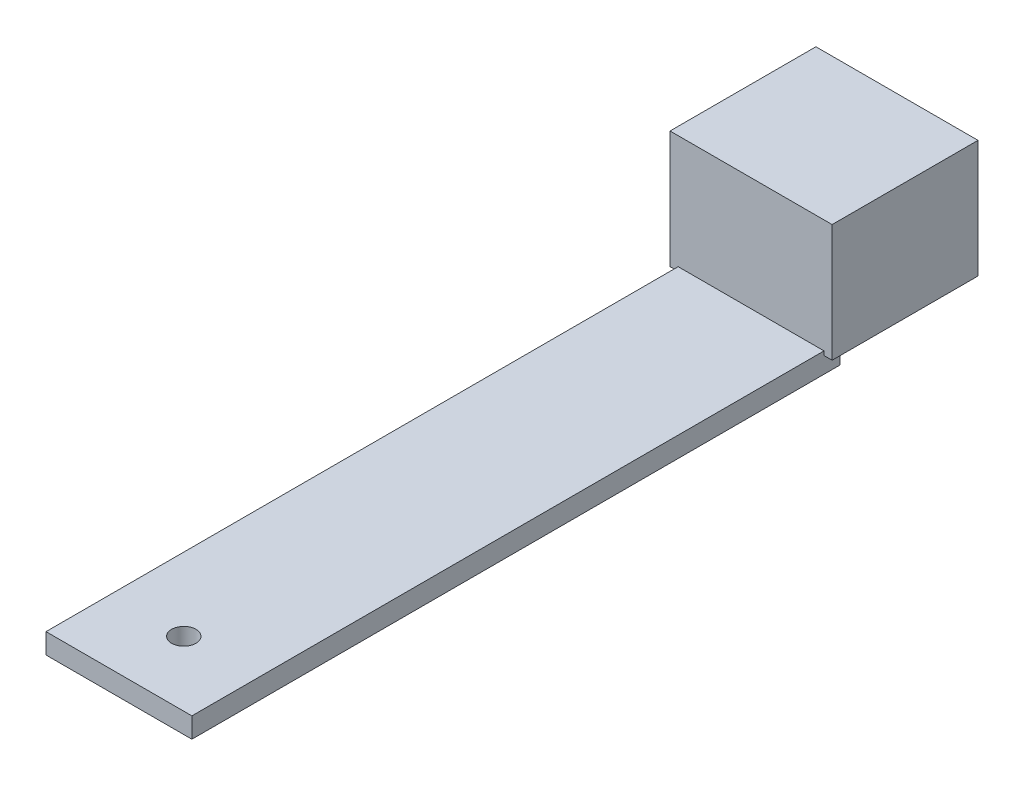
from build123d import *

# Parameters (mm, degrees)
S_BOX1_W     = 18
S_BOX1_H     = 2.5
BOSS_1_DEPTH = 80
S_BOX2_W     = 20
S_BOX2_H     = 14.5
BOSS_2_DEPTH = 18
S_HOLE3_R    = 1.5
HOLE_3_DEPTH = 2.7


with BuildPart() as part:
    # S_box1 → Boss_1 (new body)
    with BuildSketch(Plane.XY.offset(-72)):
        with Locations((0, -19.45)):
            Rectangle(S_BOX1_W, S_BOX1_H)
    extrude(amount=BOSS_1_DEPTH)

    # S_box2 → Boss_2 (add)
    with BuildSketch(Plane.XY.offset(-88)):
        with Locations((0, -11.45)):
            Rectangle(S_BOX2_W, S_BOX2_H)
    extrude(amount=BOSS_2_DEPTH)

    # S_hole3 → Hole_3 (cut)
    with BuildSketch(Plane(origin=(0, -20.8, 0), x_dir=(1, 0, 0), z_dir=(0, 1, 0))):
        with Locations(Location((0, 0, 0), (0, 0, 90))):
            Circle(S_HOLE3_R)
    extrude(amount=HOLE_3_DEPTH, mode=Mode.SUBTRACT)


solid = part.part
